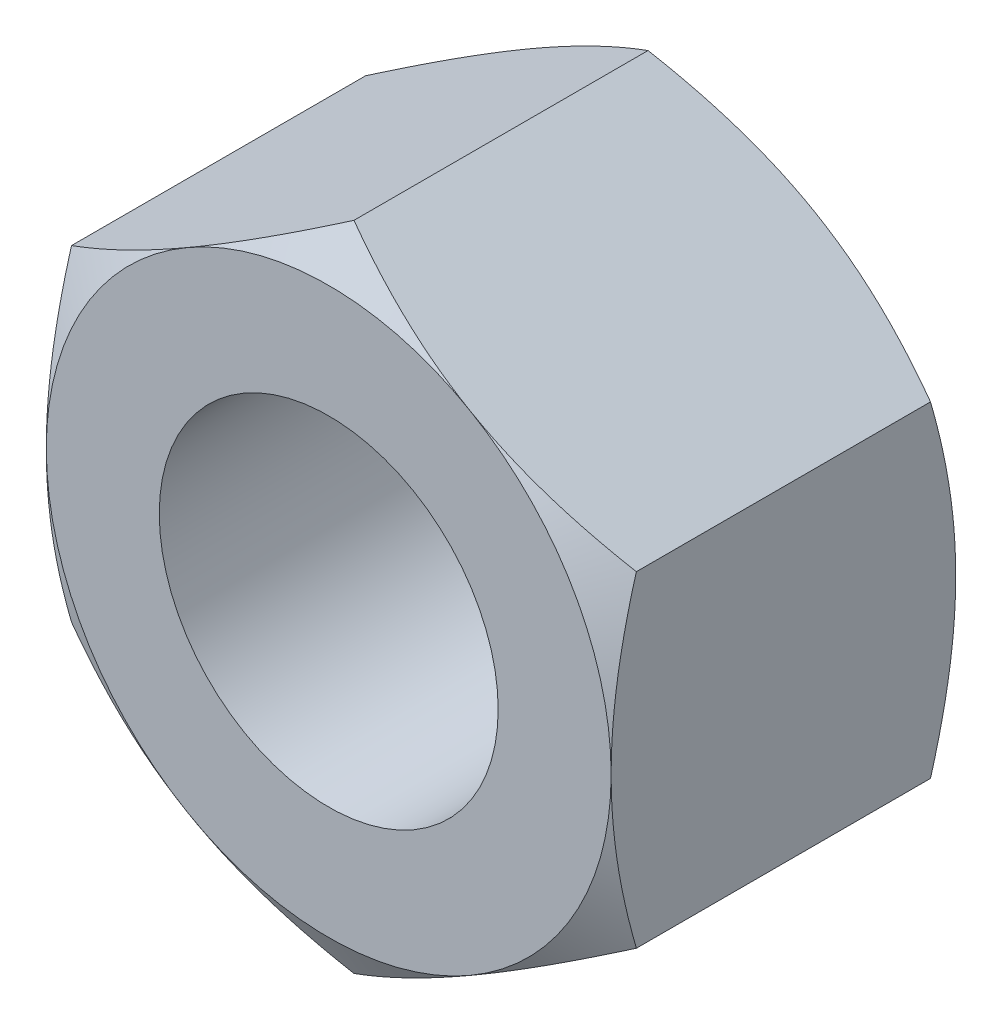
from build123d import *

# Parameters (mm, degrees)
BASENUT_START = -6.1
BASENUTSKE_R  = 3
BASENUT_DEPTH = 6.1


with BuildPart() as part:
    # BaseNutSke → BaseNut (new body)
    with BuildSketch(Plane.XY.offset(BASENUT_START)):
        Polygon((5, 2.886751346), (5, -2.886751346), (0, -5.773502692), (-5, -2.886751346), (-5, 2.886751346), (0, 5.773502692), align=None)
        Circle(BASENUTSKE_R, mode=Mode.SUBTRACT)
    extrude(amount=BASENUT_DEPTH)

    # Sketch3 → Double-Chamfer (revolve, cut)
    with BuildSketch(Plane(origin=(0, 0, 0), x_dir=(0, 0, -1), z_dir=(1, 0, 0))):
        Polygon((6.1, 5), (5.653418013, 5.773502692), (5.653418013, 15.773502692), (16.1, 15.773502692), (16.1, 5), align=None)
        Polygon((0.446581987, 15.773502692), (-10, 15.773502692), (-10, 5), (0, 5), (0.446581987, 5.773502692), align=None)
    revolve(axis=Axis((0, 0, 0), (0, 0, -1)), mode=Mode.SUBTRACT)

    # Sketch5 → EndChamfer (revolve, cut)
    with BuildSketch(Plane(origin=(0, 0, 0), x_dir=(0, 0, -1), z_dir=(1, 0, 0))):
        Polygon((6.0746, 3), (5.689485854, 2.45), (6.1254, 2.45), (6.1254, 3), align=None)
        Polygon((-0.0508, 3), (0, 3), (0.385114146, 2.45), (-0.0508, 2.45), align=None)
    revolve(axis=Axis((0, 0, -25.037505729), (0, 0, -1)), mode=Mode.SUBTRACT)


solid = part.part
